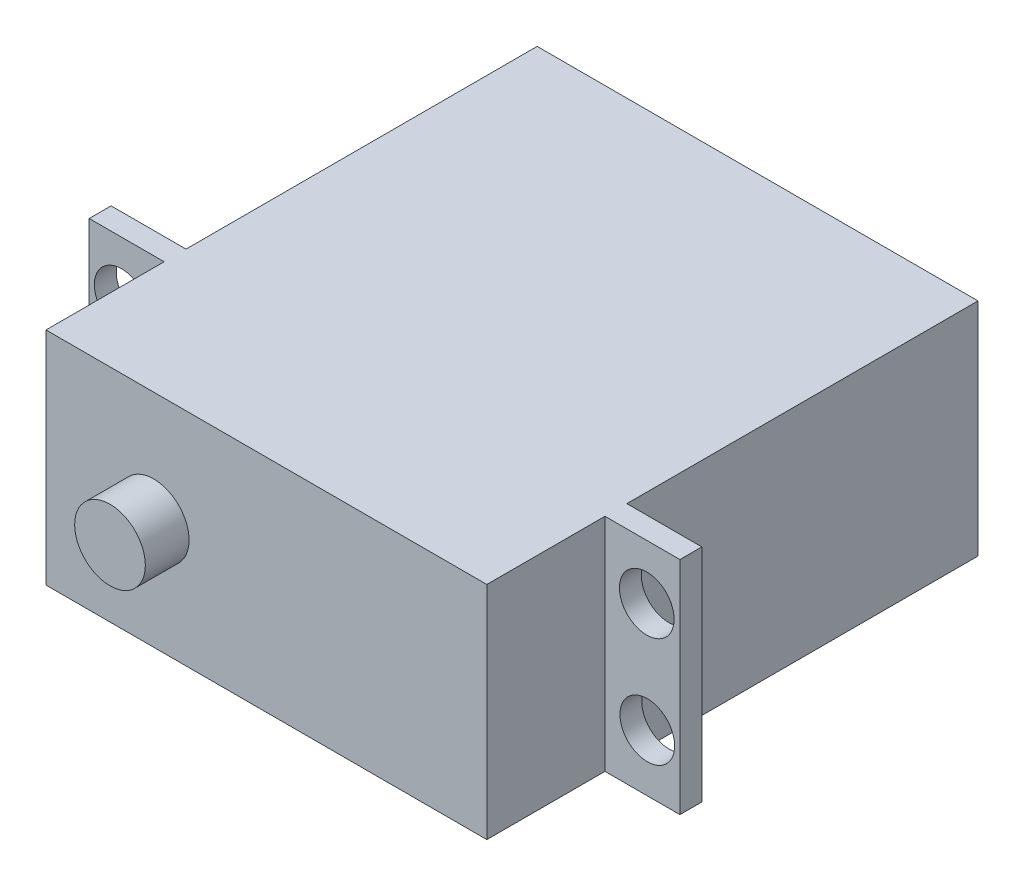
from build123d import *

# Parameters (mm, degrees)
ESQUISSE1_W             = 40.3
ESQUISSE1_H             = 20.2
BOSS_EXTRU_1_DEPTH      = 32.1
ESQUISSE2_W             = 54
ESQUISSE2_H             = 20.2
BOSS_EXTRU_2_DEPTH      = 2
ESQUISSE3_W             = 40.3
ESQUISSE3_H             = 20.2
BOSS_EXTRU_3_DEPTH      = 10.8
ESQUISSE4_R             = 3.230106489
BOSS_EXTRU_4_DEPTH      = 4
ESQUISSE5_R             = 2.5
ENL_V_MAT_EXTRU_1_DEPTH = 4


with BuildPart() as part:
    # Esquisse1 → Boss.-Extru.1 (new body)
    with BuildSketch(Plane.XY):
        with Locations((20.15, 5.491176471)):
            Rectangle(ESQUISSE1_W, ESQUISSE1_H)
    extrude(amount=BOSS_EXTRU_1_DEPTH)

    # Esquisse2 → Boss.-Extru.2 (add)
    with BuildSketch(Plane.XY.offset(32.1)):
        with Locations((20.15, 5.491176471)):
            Rectangle(ESQUISSE2_W, ESQUISSE2_H)
    extrude(amount=BOSS_EXTRU_2_DEPTH)

    # Esquisse3 → Boss.-Extru.3 (add)
    with BuildSketch(Plane.XY.offset(34.1)):
        with Locations((20.15, 5.491176471)):
            Rectangle(ESQUISSE3_W, ESQUISSE3_H)
    extrude(amount=BOSS_EXTRU_3_DEPTH)

    # Esquisse4 → Boss.-Extru.4 (add)
    with BuildSketch(Plane.XY.offset(44.9)):
        with Locations(Location((9.85, 5.491176471, 0), (0, 0, 180))):
            Circle(ESQUISSE4_R)
    extrude(amount=BOSS_EXTRU_4_DEPTH)

    # Esquisse5 → Enlèv. mat.-Extru.1 (cut)
    with BuildSketch(Plane.XY.offset(34.1)):
        with Locations((-3.88, 10.591176471)):
            Circle(ESQUISSE5_R)
        with Locations((-3.832055369, 0.591291406)):
            Circle(ESQUISSE5_R)
        with Locations((44.12, 10.591176471)):
            Circle(ESQUISSE5_R)
        with Locations((44.167944631, 0.591291406)):
            Circle(ESQUISSE5_R)
    extrude(amount=-ENL_V_MAT_EXTRU_1_DEPTH, mode=Mode.SUBTRACT)


solid = part.part
